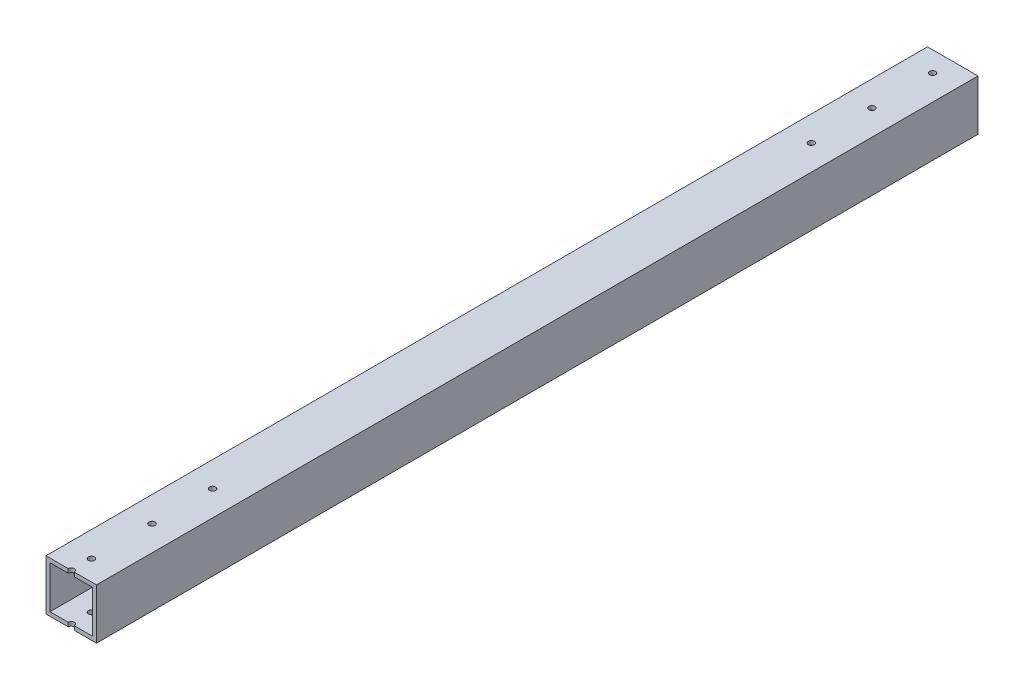
from build123d import *

# Parameters (mm, degrees)
SKETCH1_W           = 25
SKETCH1_H           = 25
SKETCH1_W_2         = 21
SKETCH1_H_2         = 21
BOSS_EXTRUDE1_DEPTH = 436.5
SKETCH2_R           = 1.5
CUT_EXTRUDE1_DEPTH  = 438.393987156
SKETCH3_R           = 1.5
CUT_EXTRUDE2_DEPTH  = 429


with BuildPart() as part:
    # Sketch1 → Boss-Extrude1 (new body)
    with BuildSketch(Plane.XY):
        Rectangle(SKETCH1_W, SKETCH1_H)
        Rectangle(SKETCH1_W_2, SKETCH1_H_2, mode=Mode.SUBTRACT)
    extrude(amount=-BOSS_EXTRUDE1_DEPTH)

    # Sketch2 → Cut-Extrude1 (cut, through all)
    with BuildSketch(Plane(origin=(0, 12.5, 0), x_dir=(1, 0, 0), z_dir=(0, 1, 0))):
        with Locations(Location((0, 366.5, 0), (0, 0, 270))):
            Circle(SKETCH2_R)
        with Locations(Location((0, 396.5, 0), (0, 0, 270))):
            Circle(SKETCH2_R)
        with Locations(Location((0, 426.5, 0), (0, 0, 270))):
            Circle(SKETCH2_R)
    cut_extrude1 = extrude(amount=-CUT_EXTRUDE1_DEPTH, mode=Mode.SUBTRACT)

    # Sketch3 → Cut-Extrude2 (cut)
    with BuildSketch(Plane(origin=(0, 12.5, 0), x_dir=(1, 0, 0), z_dir=(0, 1, 0))):
        Circle(SKETCH3_R)
    extrude(amount=-CUT_EXTRUDE2_DEPTH, mode=Mode.SUBTRACT)

    # Mirror1: Cut-Extrude1 across plane
    add(cut_extrude1.mirror(Plane.XY.offset(-218.25)), mode=Mode.SUBTRACT)


solid = part.part
